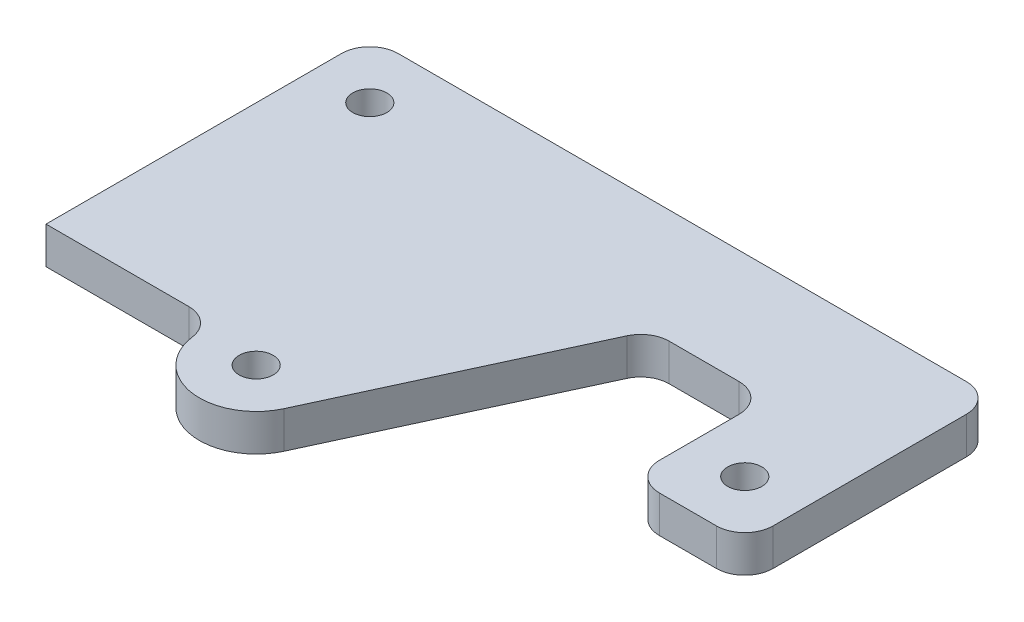
from build123d import *

# Parameters (mm, degrees)
SKETCH_1_R      = 3
EXTRUDE_1_DEPTH = 6.5


with BuildPart() as part:
    # 스케치1 → 보스-돌출1 (new body)
    with BuildSketch(Plane(origin=(0, 0, 0), x_dir=(1, 0, 0), z_dir=(0, 1, 0))):
        with BuildLine():
            Line((0, 0), (0, 52))
            ThreePointArc((0, 52), (1.464466094, 55.535533906), (5, 57))
            Line((5, 57), (105, 57))
            ThreePointArc((105, 57), (108.535533906, 55.535533906), (110, 52))
            Line((110, 52), (110, 18))
            ThreePointArc((110, 18), (108.535533906, 14.464466094), (105, 13))
            Line((105, 13), (95, 13))
            ThreePointArc((95, 13), (91.464466094, 14.464466094), (90, 18))
            Line((90, 18), (90, 32))
            ThreePointArc((90, 32), (88.535533906, 35.535533906), (85, 37))
            Line((85, 37), (72.693946289, 37))
            ThreePointArc((72.693946289, 37), (70, 36.212202915), (68.154966925, 34.097061358))
            Line((68.154966925, 34.097061358), (49.077958727, -7.194122715))
            ThreePointArc((49.077958727, -7.194122715), (38.51023536, -12.888407421), (30.089287502, -4.333333333))
            ThreePointArc((30.089287502, -4.333333333), (28.425334196, -1.236136736), (25.133931253, 0))
            Line((25.133931253, 0), (0, 0))
        make_face()
        with Locations(Location((10, 47, 0), (0, 0, 90))):
            Circle(SKETCH_1_R, mode=Mode.SUBTRACT)
        with Locations(Location((40, -3, 0), (0, 0, 90))):
            Circle(SKETCH_1_R, mode=Mode.SUBTRACT)
        with Locations(Location((100, 23, 0), (0, 0, 90))):
            Circle(SKETCH_1_R, mode=Mode.SUBTRACT)
    extrude(amount=EXTRUDE_1_DEPTH)


solid = part.part
